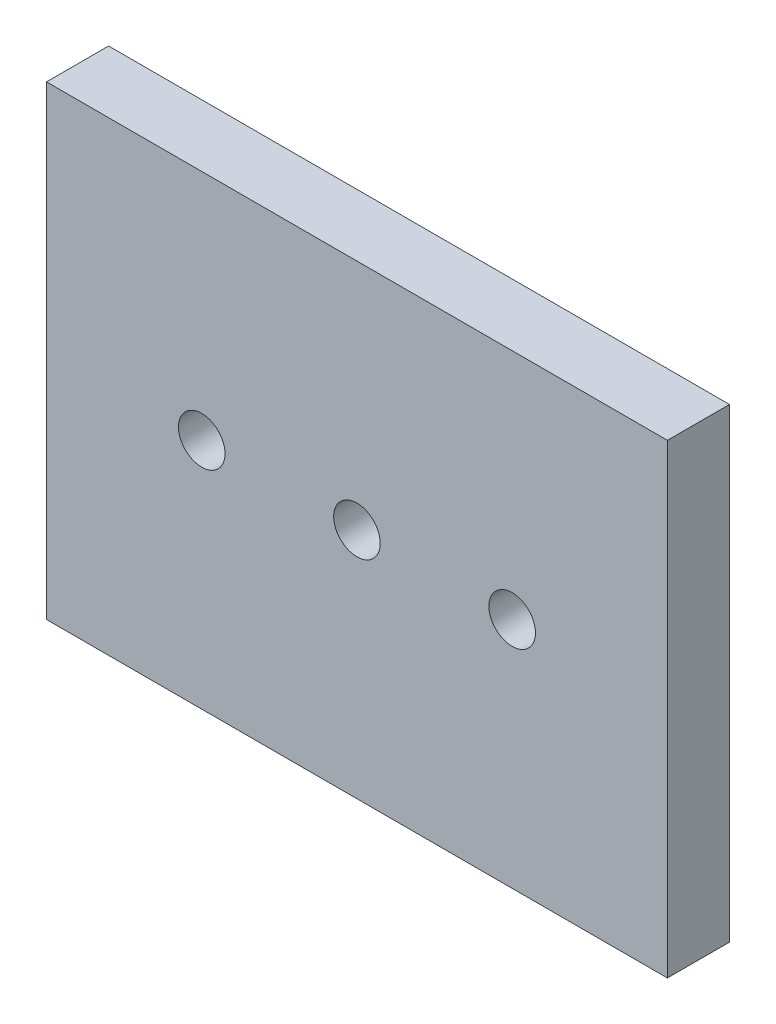
from build123d import *

# Parameters (mm, degrees)
ESBO_O1_W                = 40
ESBO_O1_H                = 30
RESSALTO_EXTRUS_O1_DEPTH = 4
CORTE_EXTRUS_O1_REACH    = 27.318
ESBO_O2_R                = 1.5


with BuildPart() as part:
    # Esboço1 → Ressalto-extrusão1 (new body)
    with BuildSketch(Plane.XY):
        Rectangle(ESBO_O1_W, ESBO_O1_H)
    extrude(amount=RESSALTO_EXTRUS_O1_DEPTH)

    # Esboço2 → Corte-extrusão1 (cut, up to next)
    with BuildSketch(Plane.XY.offset(4), mode=Mode.PRIVATE) as corte_extrus_o1_sk1:
        Circle(ESBO_O2_R)
    corte_extrus_o1_tool1 = extrude(corte_extrus_o1_sk1.sketch, amount=-CORTE_EXTRUS_O1_REACH, mode=Mode.PRIVATE) & part.part
    # Esboço2 → Corte-extrusão1 (cut, up to next)
    with BuildSketch(Plane.XY.offset(4), mode=Mode.PRIVATE) as corte_extrus_o1_sk2:
        with Locations((-10, 0)):
            Circle(ESBO_O2_R)
    corte_extrus_o1_tool2 = extrude(corte_extrus_o1_sk2.sketch, amount=-CORTE_EXTRUS_O1_REACH, mode=Mode.PRIVATE) & part.part
    # Esboço2 → Corte-extrusão1 (cut, up to next)
    with BuildSketch(Plane.XY.offset(4), mode=Mode.PRIVATE) as corte_extrus_o1_sk3:
        with Locations((10, 0)):
            Circle(ESBO_O2_R)
    corte_extrus_o1_tool3 = extrude(corte_extrus_o1_sk3.sketch, amount=-CORTE_EXTRUS_O1_REACH, mode=Mode.PRIVATE) & part.part
    add(corte_extrus_o1_tool1.solids().sort_by_distance((0, 0, 4))[0], mode=Mode.SUBTRACT)
    add(corte_extrus_o1_tool2.solids().sort_by_distance((-10, 0, 4))[0], mode=Mode.SUBTRACT)
    add(corte_extrus_o1_tool3.solids().sort_by_distance((10, 0, 4))[0], mode=Mode.SUBTRACT)


solid = part.part
